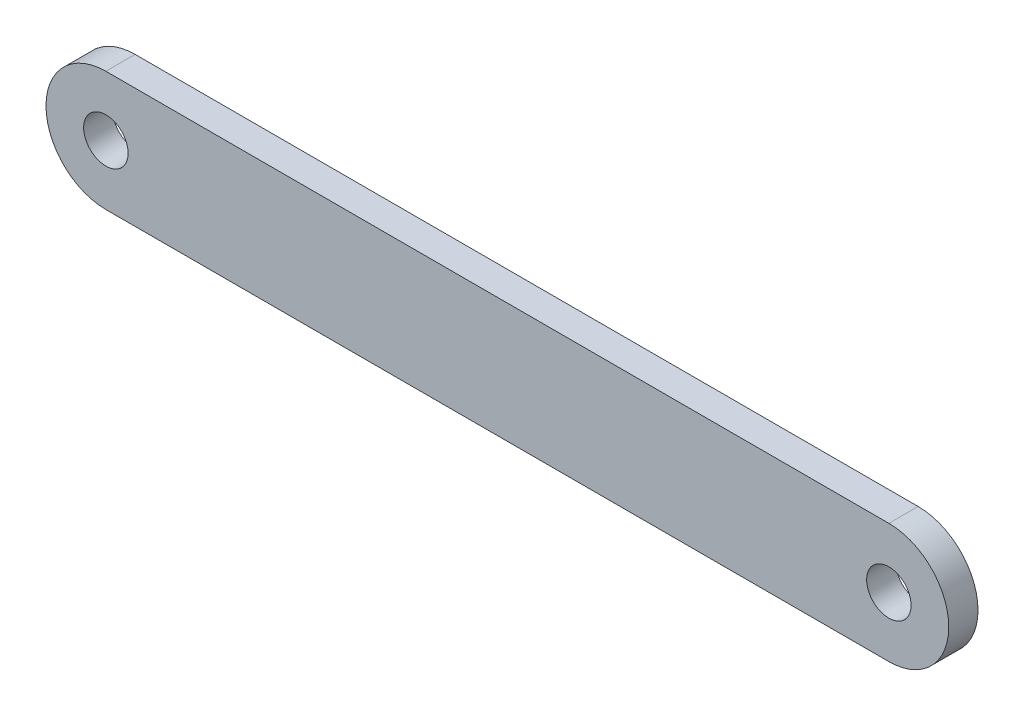
from build123d import *

# Parameters (mm, degrees)
SKETCH1_R           = 2.413
BOSS_EXTRUDE1_DEPTH = 3.175


with BuildPart() as part:
    # Sketch1 → Boss-Extrude1 (new body)
    with BuildSketch(Plane.XY):
        with BuildLine():
            Line((-42.5, 6.5), (42.5, 6.5))
            ThreePointArc((42.5, 6.5), (49, 0), (42.5, -6.5))
            Line((42.5, -6.5), (-42.5, -6.5))
            ThreePointArc((-42.5, -6.5), (-49, 0), (-42.5, 6.5))
        make_face()
        with Locations((-42.5, 0)):
            Circle(SKETCH1_R, mode=Mode.SUBTRACT)
        with Locations((42.5, 0)):
            Circle(SKETCH1_R, mode=Mode.SUBTRACT)
    extrude(amount=BOSS_EXTRUDE1_DEPTH)


solid = part.part
